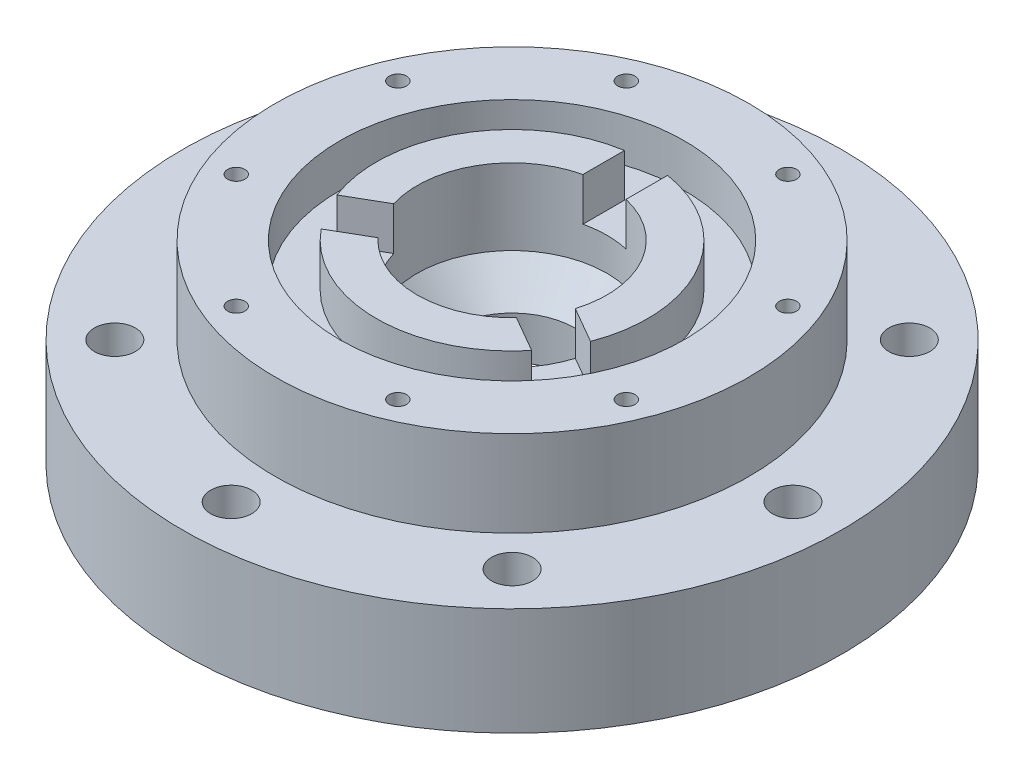
from build123d import *

# Parameters (mm, degrees)
SKETCH4_R          = 4.7625
CUT_EXTRUDE2_DEPTH = 114.707959264
CIRPATTERN1_COUNT  = 8
SKETCH6_R          = 40
SKETCH6_R_2        = 31.5
CUT_EXTRUDE3_DEPTH = 10
SKETCH7_W          = 10
SKETCH7_H          = 10.050043706
CUT_EXTRUDE4_DEPTH = 10
CIRPATTERN2_COUNT  = 3
SKETCH9_R          = 2
CUT_EXTRUDE5_DEPTH = 10
CIRPATTERN3_COUNT  = 8


with BuildPart() as part:
    # Sketch3 → Revolve1 (revolve)
    with BuildSketch(Plane(origin=(0, 0, 0), x_dir=(0, 0, -1), z_dir=(1, 0, 0))):
        with BuildLine():
            Line((76.5, 15), (55, 15))
            Line((55, 15), (55, 35))
            Line((55, 35), (22.025, 35))
            Line((22.025, 35), (22.025, 17.36))
            Line((22.025, 17.36), (14.665, 10))
            Line((14.665, 10), (14.665, 0))
            Line((14.665, 0), (19.665, 0))
            ThreePointArc((19.665, 0), (40.232841234, 6.880454009), (53.85, -10))
            Line((53.85, -10), (76.5, -10))
            Line((76.5, -10), (76.5, 15))
        make_face()
    revolve(axis=Axis((0, 0, 0), (0, 1, 0)))

    # Sketch4 → Cut-Extrude2 (cut, symmetric)
    with BuildSketch(Plane(origin=(0, 0, 0), x_dir=(1, 0, 0), z_dir=(0, 1, 0))):
        with Locations(Location((-65.2, 0, 0), (0, 0, 270))):
            Circle(SKETCH4_R)
    cut_extrude2 = extrude(amount=CUT_EXTRUDE2_DEPTH, both=True, mode=Mode.SUBTRACT)

    # CirPattern1: Cut-Extrude2 ×8 about axis
    cirpattern1_axis = Axis((0, 0, 0), (0, 1, 0))
    for i in range(1, CIRPATTERN1_COUNT):
        add(cut_extrude2.rotate(cirpattern1_axis, i * 360 / CIRPATTERN1_COUNT), mode=Mode.SUBTRACT)

    # Sketch6 → Cut-Extrude3 (cut)
    with BuildSketch(Plane(origin=(0, 35, 0), x_dir=(1, 0, 0), z_dir=(0, 1, 0))):
        with Locations(Location((0, 0, 0), (0, 0, 270))):
            Circle(SKETCH6_R)
        with Locations(Location((0, 0, 0), (0, 0, 270))):
            Circle(SKETCH6_R_2, mode=Mode.SUBTRACT)
    extrude(amount=-CUT_EXTRUDE3_DEPTH, mode=Mode.SUBTRACT)

    # Sketch7 → Cut-Extrude4 (cut)
    with BuildSketch(Plane(origin=(0, 35, 0), x_dir=(1, 0, 0), z_dir=(0, 1, 0))):
        with Locations((0, 26.474978147)):
            Rectangle(SKETCH7_W, SKETCH7_H)
    cut_extrude4 = extrude(amount=-CUT_EXTRUDE4_DEPTH, mode=Mode.SUBTRACT)

    # CirPattern2: Cut-Extrude4 ×3 about axis
    cirpattern2_axis = Axis((0, 0, 0), (0, 1, 0))
    for i in range(1, CIRPATTERN2_COUNT):
        add(cut_extrude4.rotate(cirpattern2_axis, i * 360 / CIRPATTERN2_COUNT), mode=Mode.SUBTRACT)

    # Sketch9 → Cut-Extrude5 (cut)
    with BuildSketch(Plane(origin=(0, 35, 0), x_dir=(1, 0, 0), z_dir=(0, 1, 0))):
        with Locations(Location((45.270097093, 18.751488186, 0), (0, 0, 270))):
            Circle(SKETCH9_R)
    cut_extrude5 = extrude(amount=-CUT_EXTRUDE5_DEPTH, mode=Mode.SUBTRACT)

    # CirPattern3: Cut-Extrude5 ×8 about axis
    cirpattern3_axis = Axis((0, 0, 0), (0, 1, 0))
    for i in range(1, CIRPATTERN3_COUNT):
        add(cut_extrude5.rotate(cirpattern3_axis, i * 360 / CIRPATTERN3_COUNT), mode=Mode.SUBTRACT)


solid = part.part
